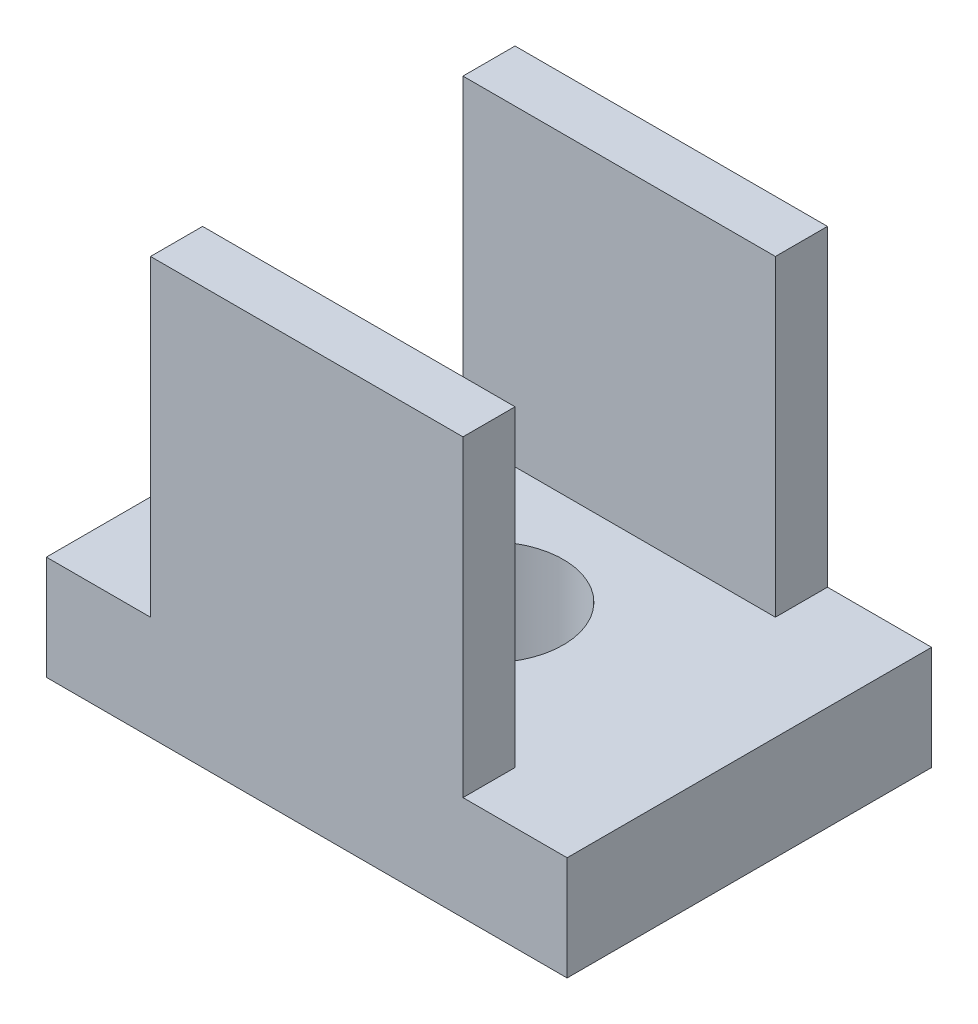
from build123d import *

# Parameters (mm, degrees)
SKETCH1_W           = 10
SKETCH1_H           = 7
SKETCH1_R           = 1.425
BOSS_EXTRUDE1_DEPTH = 2
SKETCH2_W           = 6
SKETCH2_H           = 1
BOSS_EXTRUDE2_DEPTH = 6


with BuildPart() as part:
    # Sketch1 → Boss-Extrude1 (new body)
    with BuildSketch(Plane(origin=(0, 0, 0), x_dir=(1, 0, 0), z_dir=(0, 1, 0))):
        Rectangle(SKETCH1_W, SKETCH1_H)
        with Locations(Location((0, 0, 0), (0, 0, 270))):
            Circle(SKETCH1_R, mode=Mode.SUBTRACT)
    extrude(amount=BOSS_EXTRUDE1_DEPTH)

    # Sketch2 → Boss-Extrude2 (add)
    with BuildSketch(Plane(origin=(0, 2, 0), x_dir=(1, 0, 0), z_dir=(0, 1, 0))):
        with Locations((0, -3)):
            Rectangle(SKETCH2_W, SKETCH2_H)
        with Locations((0, 3)):
            Rectangle(SKETCH2_W, SKETCH2_H)
    extrude(amount=BOSS_EXTRUDE2_DEPTH)


solid = part.part
